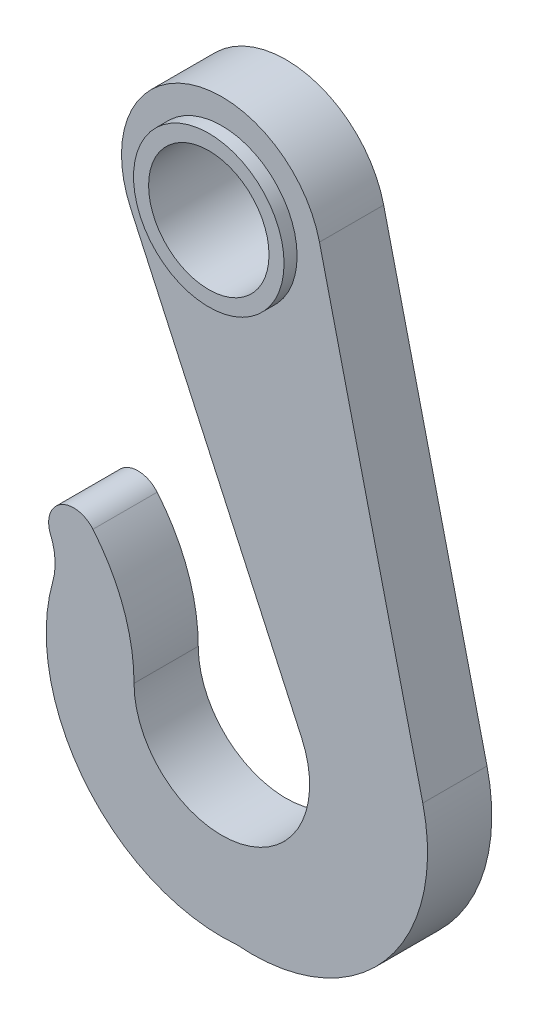
from build123d import *

# Parameters (mm, degrees)
SALIENTE_EXTRUIR1_DEPTH = 0.64
CROQUIS4_R              = 0.75
CROQUIS4_R_2            = 0.6
SALIENTE_EXTRUIR2_DEPTH = 0.13
SALIENTE_EXTRUIR3_START = 0.13
CROQUIS5_R              = 0.75
CROQUIS5_R_2            = 0.6
SALIENTE_EXTRUIR3_DEPTH = 0.13
CORTAR_EXTRUIR1_START   = -0.64
CROQUIS6_R              = 0.6
CORTAR_EXTRUIR1_DEPTH   = 0.64


with BuildPart() as part:
    # Croquis2 → Saliente-Extruir1 (new body)
    with BuildSketch(Plane.XY):
        with BuildLine():
            Line((0.972829673, 0.231521978), (2.002451929, -4.094836538))
            ThreePointArc((2.002451929, -4.094836538), (1.62543556, -5.642681311), (0.15, -6.243559577))
            ThreePointArc((0.15, -6.243559577), (-1.349057934, -5.614693989), (-1.684007007, -4.023953364))
            ThreePointArc((-1.684007007, -4.023953364), (-1.662402657, -3.825735404), (-1.706947307, -3.631382935))
            ThreePointArc((-1.706947307, -3.631382935), (-1.605577372, -3.322060723), (-1.284422225, -3.375121683))
            ThreePointArc((-1.284422225, -3.375121683), (-0.980537914, -3.901464749), (-0.875, -4.5))
            ThreePointArc((-0.875, -4.5), (0.186583012, -5.354875301), (0.795426925, -4.135416667))
            Line((0.795426925, -4.135416667), (-0.909059343, -0.416666667))
            ThreePointArc((-0.909059343, -0.416666667), (-0.325659014, 0.945487285), (0.972829673, 0.231521978))
        make_face()
    extrude(amount=SALIENTE_EXTRUIR1_DEPTH)

    # Croquis4 → Saliente-Extruir2 (add)
    with BuildSketch(Plane.XY.offset(0.64)):
        Circle(CROQUIS4_R)
        Circle(CROQUIS4_R_2, mode=Mode.SUBTRACT)
    extrude(amount=SALIENTE_EXTRUIR2_DEPTH)

    # Croquis5 → Saliente-Extruir3 (add)
    with BuildSketch(Plane(origin=(0, 0, 0), x_dir=(-1, 0, 0), z_dir=(0, 0, -1)).offset(SALIENTE_EXTRUIR3_START)):
        with Locations(Location((0, 0, 0), (0, 0, 180))):
            Circle(CROQUIS5_R)
        with Locations(Location((0, 0, 0), (0, 0, 180))):
            Circle(CROQUIS5_R_2, mode=Mode.SUBTRACT)
    extrude(amount=-SALIENTE_EXTRUIR3_DEPTH)

    # Croquis6 → Cortar-Extruir1 (cut)
    with BuildSketch(Plane.XY.offset(0.64).offset(CORTAR_EXTRUIR1_START)):
        with Locations(Location((0, 0, 0), (0, 0, 180))):
            Circle(CROQUIS6_R)
    extrude(amount=CORTAR_EXTRUIR1_DEPTH, mode=Mode.SUBTRACT)


solid = part.part
